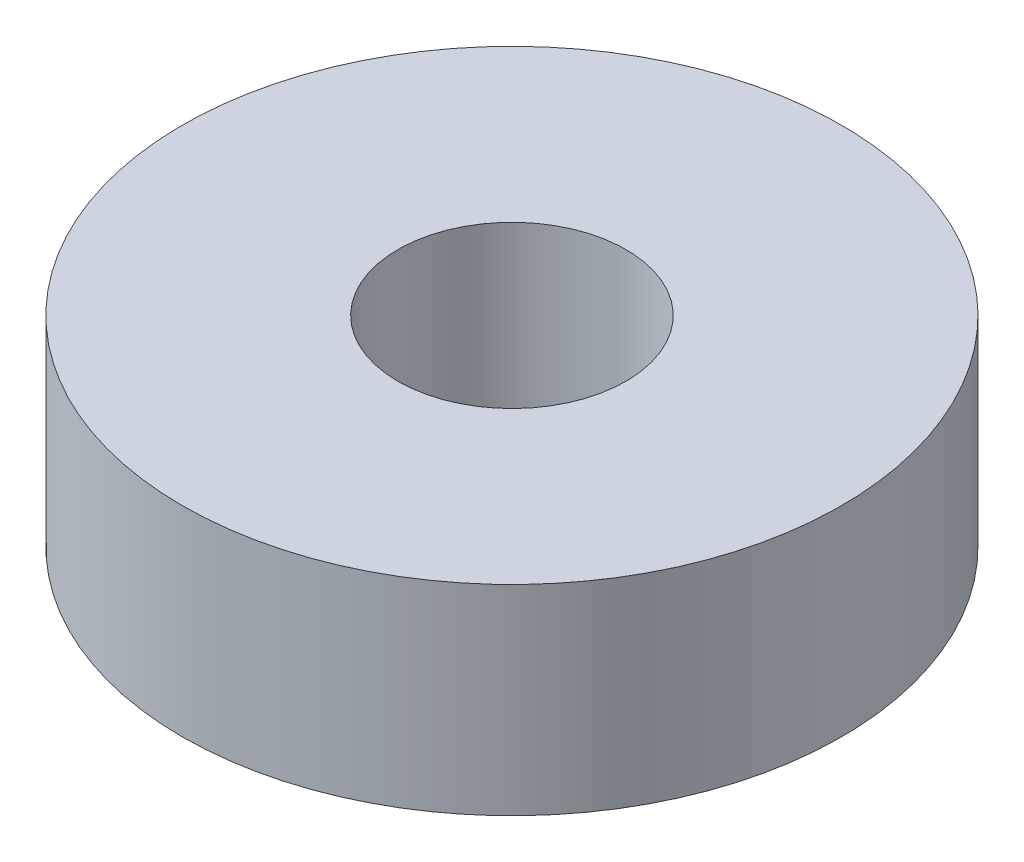
from build123d import *

# Parameters (mm, degrees)
SKETCH1_R           = 13
SKETCH1_R_2         = 4.5
BOSS_EXTRUDE1_DEPTH = 7.9


with BuildPart() as part:
    # Sketch1 → Boss-Extrude1 (new body)
    with BuildSketch(Plane(origin=(0, 0, 0), x_dir=(1, 0, 0), z_dir=(0, 1, 0))):
        with Locations(Location((0, 0, 0), (0, 0, 270))):
            Circle(SKETCH1_R)
        with Locations(Location((0, 0, 0), (0, 0, 270))):
            Circle(SKETCH1_R_2, mode=Mode.SUBTRACT)
    extrude(amount=BOSS_EXTRUDE1_DEPTH)


solid = part.part
